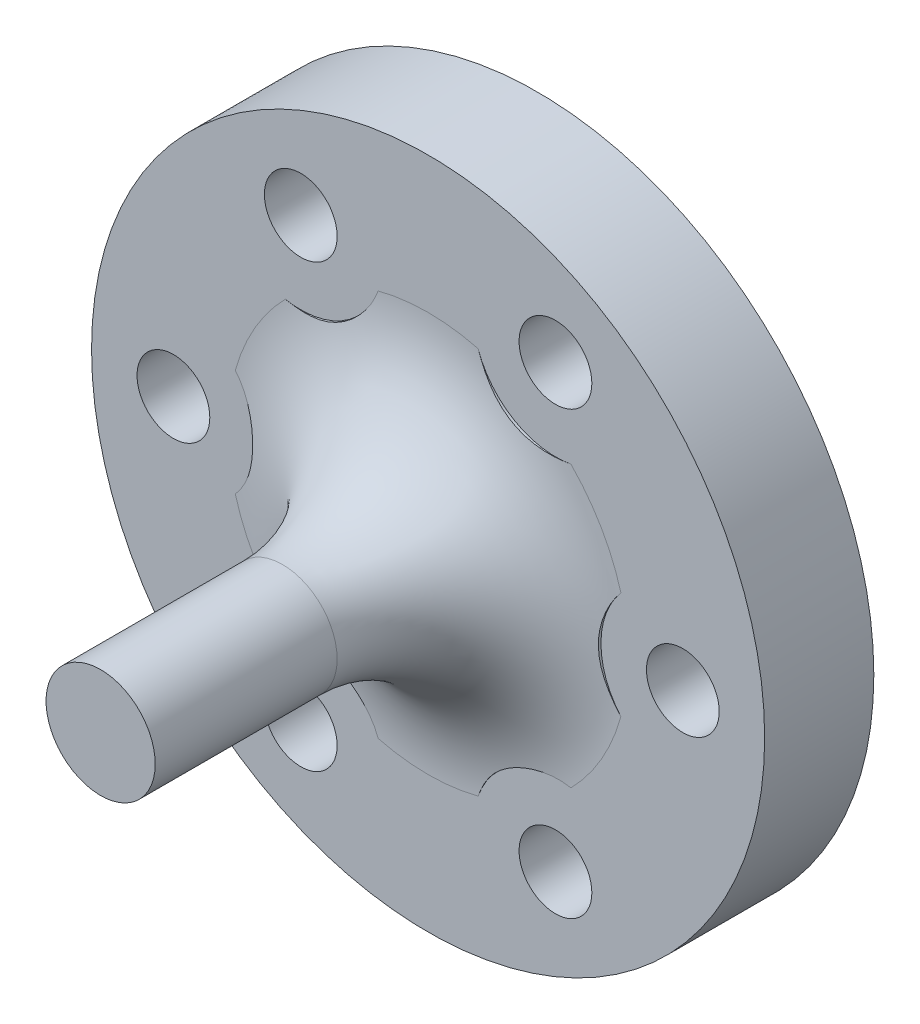
from build123d import *

# Parameters (mm, degrees)
SKETCH1_R           = 18.5
BOSS_EXTRUDE1_DEPTH = 6
SKETCH3_R           = 2
CUT_EXTRUDE1_DEPTH  = 6
SKETCH7_R           = 3
BOSS_EXTRUDE4_DEPTH = 18
FILLET3_R           = 8
SKETCH8_R           = 4.5
CUT_EXTRUDE2_DEPTH  = 10


with BuildPart() as part:
    # Sketch1 → Boss-Extrude1 (new body)
    with BuildSketch(Plane.XY):
        Circle(SKETCH1_R)
    extrude(amount=BOSS_EXTRUDE1_DEPTH)

    # Sketch3 → Cut-Extrude1 (cut)
    with BuildSketch(Plane.XY.offset(6)):
        with Locations((-14, 0)):
            Circle(SKETCH3_R)
        with Locations((-7, 12.124355653)):
            Circle(SKETCH3_R)
        with Locations((7, 12.124355653)):
            Circle(SKETCH3_R)
        with Locations((14, 0)):
            Circle(SKETCH3_R)
        with Locations((7, -12.124355653)):
            Circle(SKETCH3_R)
        with Locations((-7, -12.124355653)):
            Circle(SKETCH3_R)
    extrude(amount=-CUT_EXTRUDE1_DEPTH, mode=Mode.SUBTRACT)

    # Sketch7 → Boss-Extrude4 (add)
    with BuildSketch(Plane.XY.offset(24)):
        Circle(SKETCH7_R)
    extrude(amount=-BOSS_EXTRUDE4_DEPTH)

    # Fillet3
    fillet3_edges = [part.edges().sort_by_distance(p)[0] for p in [
        (-3, 0, 6),
    ]]
    fillet(fillet3_edges, radius=FILLET3_R)

    # Sketch8 → Cut-Extrude2 (cut)
    with BuildSketch(Plane.XY.offset(6)):
        with Locations((-14, 0)):
            Circle(SKETCH8_R)
        with Locations((-7, 12.124355653)):
            Circle(SKETCH8_R)
        with Locations((7, 12.124355653)):
            Circle(SKETCH8_R)
        with Locations((14, 0)):
            Circle(SKETCH8_R)
        with Locations((7, -12.124355653)):
            Circle(SKETCH8_R)
        with Locations((-7, -12.124355653)):
            Circle(SKETCH8_R)
    extrude(amount=CUT_EXTRUDE2_DEPTH, mode=Mode.SUBTRACT)


solid = part.part
